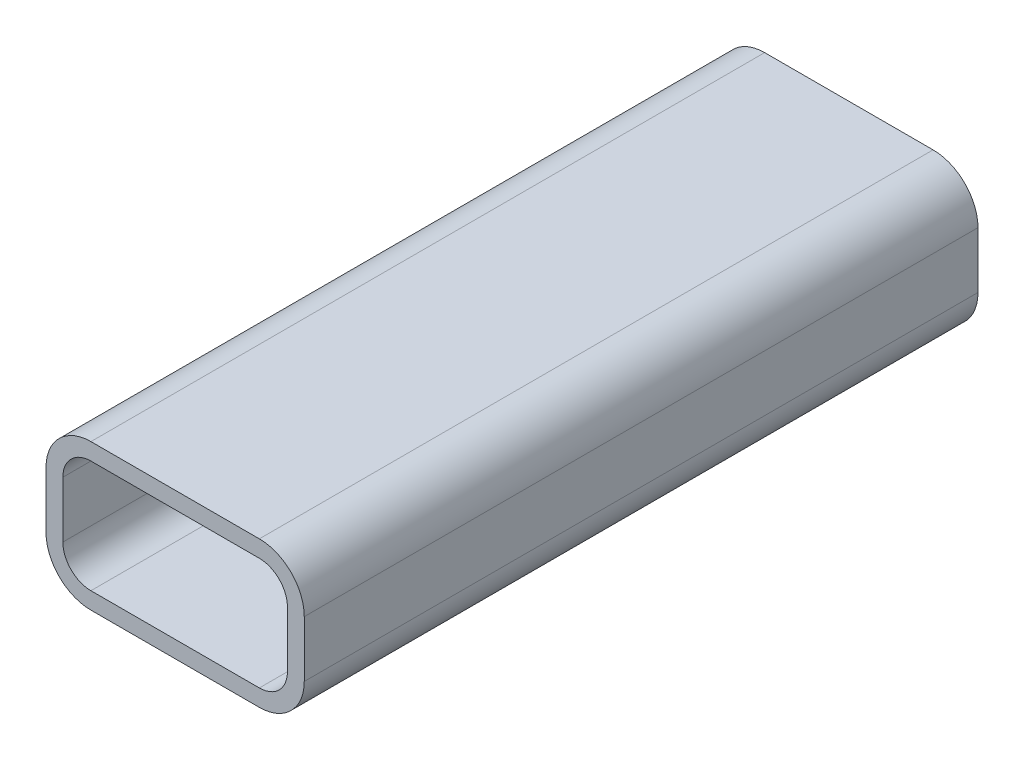
from build123d import *

# Parameters (mm, degrees)
EXTRUDE_THIN1_DEPTH = 60


with BuildPart() as part:
    # Sketch1 → Extrude-Thin1 (new, symmetric)
    with BuildSketch(Plane.XY):
        with BuildLine():
            Line((-15, 13), (15, 13))
            ThreePointArc((15, 13), (20.656854249, 10.656854249), (23, 5))
            Line((23, 5), (23, -5))
            ThreePointArc((23, -5), (20.656854249, -10.656854249), (15, -13))
            Line((15, -13), (-15, -13))
            ThreePointArc((-15, -13), (-20.656854249, -10.656854249), (-23, -5))
            Line((-23, -5), (-23, 5))
            ThreePointArc((-23, 5), (-20.656854249, 10.656854249), (-15, 13))
        make_face()
        with BuildLine():
            Line((-15, 10), (15, 10))
            ThreePointArc((15, 10), (18.535533906, 8.535533906), (20, 5))
            Line((20, 5), (20, -5))
            ThreePointArc((20, -5), (18.535533906, -8.535533906), (15, -10))
            Line((15, -10), (-15, -10))
            ThreePointArc((-15, -10), (-18.535533906, -8.535533906), (-20, -5))
            Line((-20, -5), (-20, 5))
            ThreePointArc((-20, 5), (-18.535533906, 8.535533906), (-15, 10))
        make_face(mode=Mode.SUBTRACT)
    extrude(amount=EXTRUDE_THIN1_DEPTH, both=True)


solid = part.part
